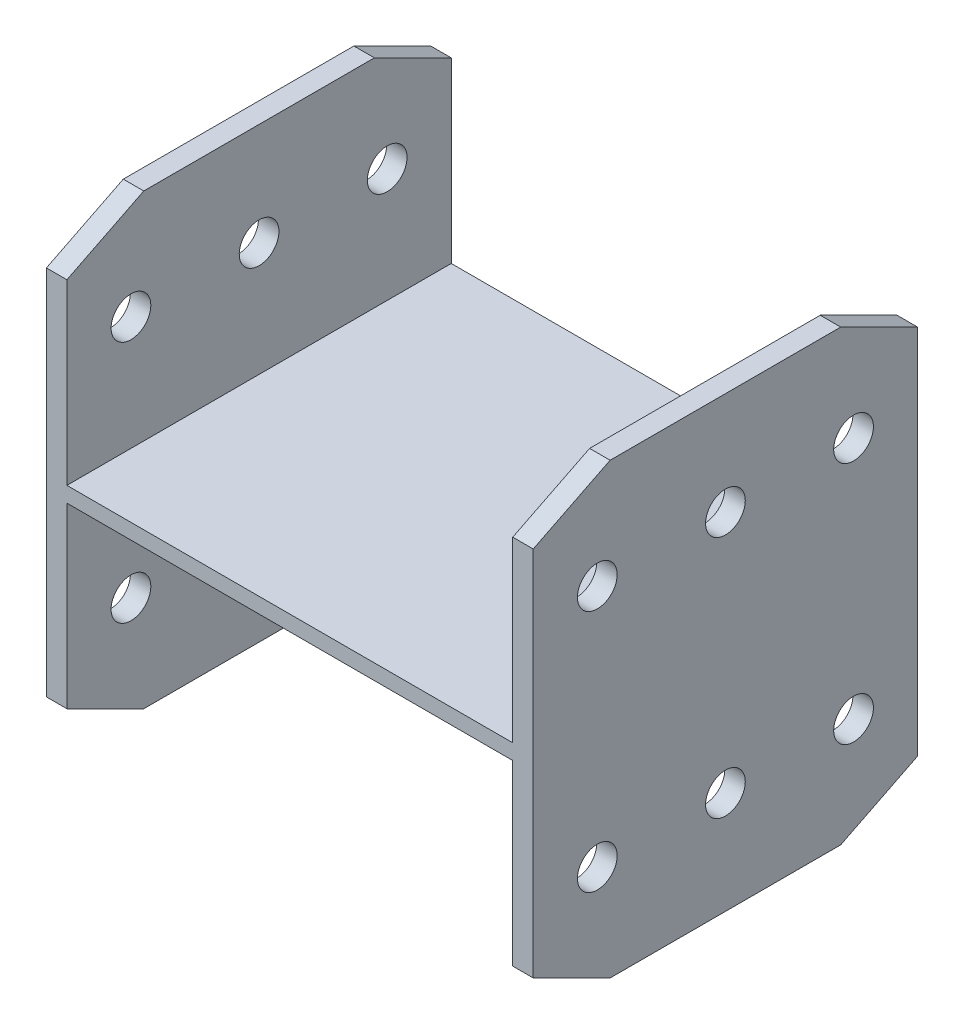
from build123d import *

# Parameters (mm, degrees)
EXTRUDE_1_DEPTH          = 150
SKETCH_2_R               = 15.5
CUT_EXTRUDE_7_DEPTH      = 445.437847173
CUT_EXTRUDE_8_DEPTH      = 299.705540625
CUT_EXTRUDE_8_DEPTH_BACK = 299.705540625


with BuildPart() as part:
    # 草图1 → 拉伸1 (new, symmetric)
    with BuildSketch(Plane.XY):
        Polygon((-174, -6), (174, -6), (174, -175), (190, -175), (190, 175), (174, 175), (174, 6), (-174, 6), (-174, 175), (-190, 175), (-190, -175), (-174, -175), align=None)
    extrude(amount=EXTRUDE_1_DEPTH, both=True)

    # 草图2 → 拉伸7 (cut, through all)
    with BuildSketch(Plane(origin=(190, 0, 0), x_dir=(0, 0, -1), z_dir=(1, 0, 0))):
        with Locations((-100, 95)):
            Circle(SKETCH_2_R)
        with Locations((0, 95)):
            Circle(SKETCH_2_R)
        with Locations((100, 95)):
            Circle(SKETCH_2_R)
        with Locations(Location((100, -95, 0), (0, 0, 270))):
            Circle(SKETCH_2_R)
        with Locations(Location((0, -95, 0), (0, 0, 270))):
            Circle(SKETCH_2_R)
        with Locations(Location((-100, -95, 0), (0, 0, 270))):
            Circle(SKETCH_2_R)
    extrude(amount=-CUT_EXTRUDE_7_DEPTH, mode=Mode.SUBTRACT)

    # 草图3 → 拉伸8 (cut, two sides: drawn at the far end of the back side and taken through both)
    with BuildSketch(Plane(origin=(0, 0, 0), x_dir=(0, 0, -1), z_dir=(1, 0, 0)).offset(-CUT_EXTRUDE_8_DEPTH_BACK)):
        Polygon((-150, 175), (-90, 175), (-150, 145), align=None)
        Polygon((150, 145), (150, 175), (90, 175), align=None)
        Polygon((150, -175), (90, -175), (150, -145), align=None)
        Polygon((-150, -145), (-150, -175), (-90, -175), align=None)
    extrude(amount=CUT_EXTRUDE_8_DEPTH + CUT_EXTRUDE_8_DEPTH_BACK, mode=Mode.SUBTRACT)


solid = part.part
